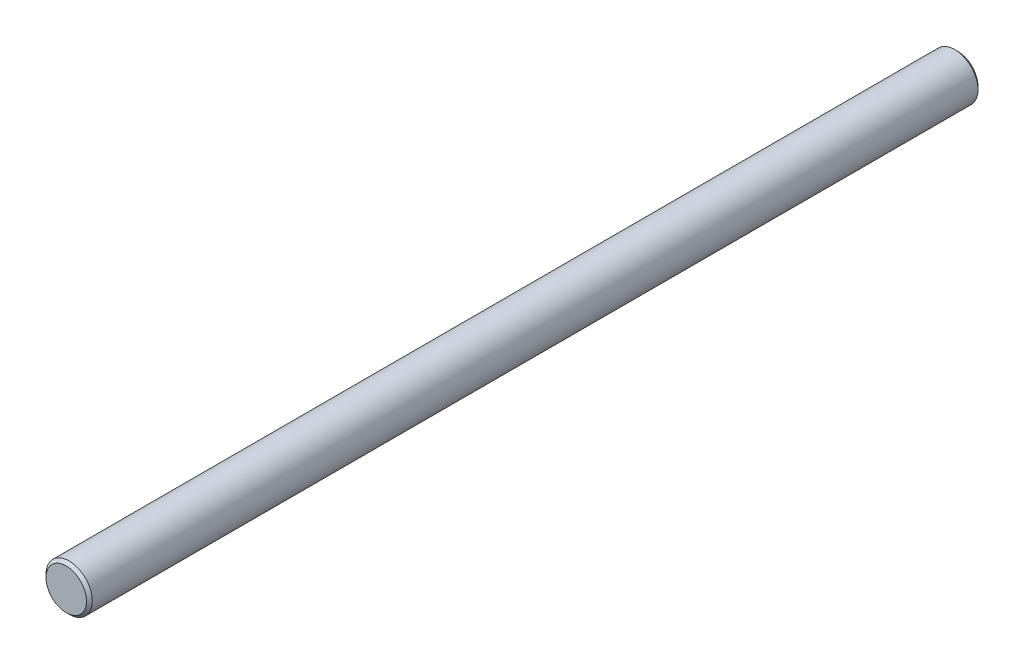
from build123d import *

# Parameters (mm, degrees)
SKETCH1_R           = 4
BOSS_EXTRUDE1_DEPTH = 77
CHAMFER1_SIZE       = 0.5


with BuildPart() as part:
    # Sketch1 → Boss-Extrude1 (new, symmetric)
    with BuildSketch(Plane.XY):
        Circle(SKETCH1_R)
    extrude(amount=BOSS_EXTRUDE1_DEPTH, both=True)

    # Chamfer1
    chamfer1_edges = [part.edges().sort_by_distance(p)[0] for p in [
        (-4, 0, -77),
        (-4, 0, 77),
    ]]
    chamfer(chamfer1_edges, length=CHAMFER1_SIZE)


solid = part.part
